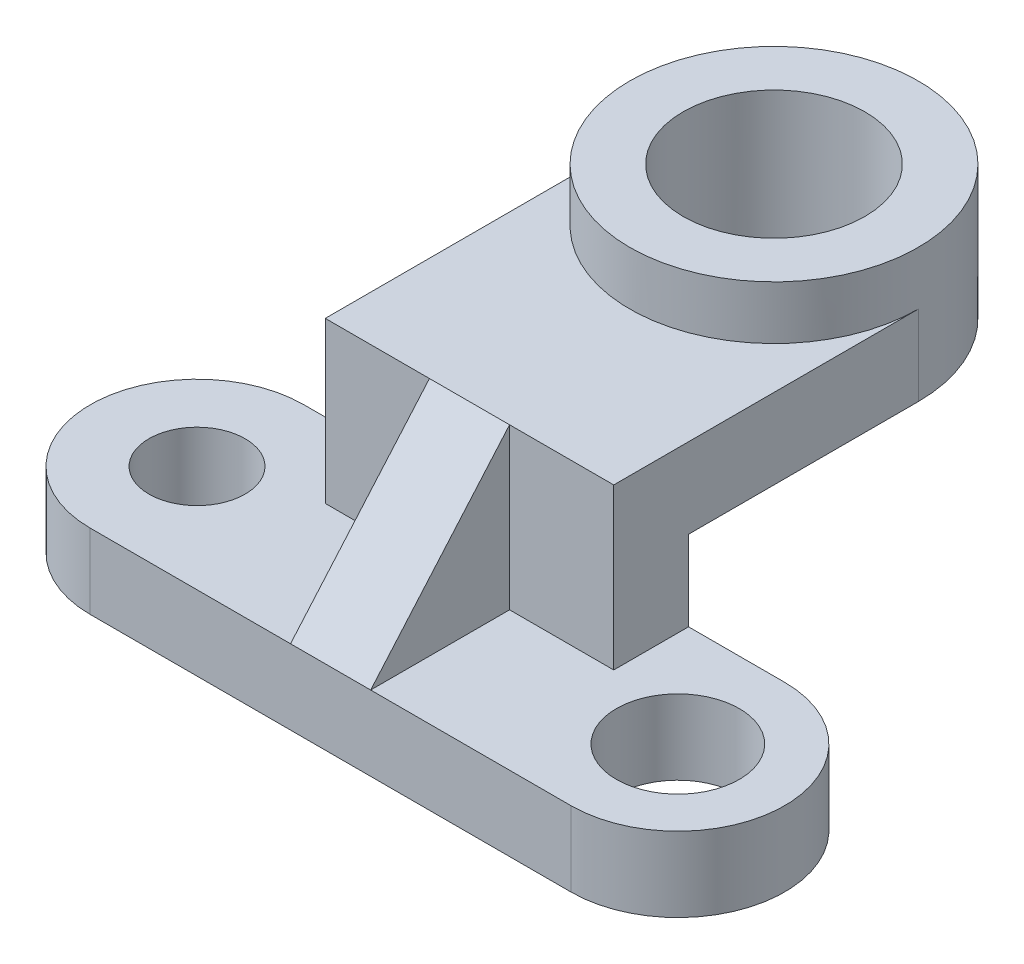
from build123d import *

# Parameters (mm, degrees)
SKETCH_1_R          = 23
SKETCH_1_R_2        = 18
EXTRUDE_1_DEPTH     = 28
EXTRUDE_3_DEPTH     = 60
SKETCH_2_5_R        = 54
SKETCH_2_5_R_2      = 34
EXTRUDE_4_DEPTH     = 80
CUT_EXTRUDE_1_DEPTH = 30
SKETCH_6_W          = 108
SKETCH_6_H          = 28
EXTRUDE_5_DEPTH     = 60
EXTRUDE_6_DEPTH     = 15


with BuildPart() as part:
    # 草图1 → 凸台-拉伸1 (new body)
    with BuildSketch(Plane(origin=(0, 0, 0), x_dir=(1, 0, 0), z_dir=(0, 1, 0))):
        with BuildLine():
            Line((0, 40), (180, 40))
            ThreePointArc((180, 40), (220, 0), (180, -40))
            Line((180, -40), (0, -40))
            ThreePointArc((0, -40), (-40, 0), (0, 40))
        make_face()
        with Locations(Location((180, 0, 0), (0, 0, 270))):
            Circle(SKETCH_1_R, mode=Mode.SUBTRACT)
        with Locations(Location((0, 0, 0), (0, 0, 270))):
            Circle(SKETCH_1_R_2, mode=Mode.SUBTRACT)
    extrude(amount=EXTRUDE_1_DEPTH)



with BuildPart() as body_2:
    # 草图2 → 凸台-拉伸3 (new body)
    with BuildSketch(Plane(origin=(0, 28, 0), x_dir=(1, 0, 0), z_dir=(0, 1, 0))):
        with BuildLine():
            Line((90, 40), (144, 40))
            Line((144, 40), (144, 126))
            ThreePointArc((144, 126), (90, 72), (36, 126))
            Line((36, 126), (36, 40))
            Line((36, 40), (90, 40))
        make_face()
    extrude(amount=EXTRUDE_3_DEPTH)

    # 草图2<5> → 凸台-拉伸4 (add)
    with BuildSketch(Plane(origin=(0, 28, 0), x_dir=(1, 0, 0), z_dir=(0, 1, 0))):
        with Locations(Location((90, 126, 0), (0, 0, 180))):
            Circle(SKETCH_2_5_R)
        with Locations(Location((90, 126, 0), (0, 0, 270))):
            Circle(SKETCH_2_5_R_2, mode=Mode.SUBTRACT)
    extrude(amount=EXTRUDE_4_DEPTH)

    # 草图4 → 切除-拉伸1 (cut)
    with BuildSketch(Plane.XZ.offset(-28)):
        with BuildLine():
            Line((36, -40), (36, -126))
            ThreePointArc((36, -126), (90, -180), (144, -126))
            Line((144, -126), (144, -40))
            Line((144, -40), (36, -40))
        make_face()
    extrude(amount=-CUT_EXTRUDE_1_DEPTH, mode=Mode.SUBTRACT)


with BuildPart() as part_1:
    add(part.part)

    add(body_2.part)  # 凸台-拉伸5 merges body 2
    # 草图6 → 凸台-拉伸5 (add)
    with BuildSketch(Plane(origin=(0, 28, 0), x_dir=(1, 0, 0), z_dir=(0, 1, 0))):
        with Locations((90, 26)):
            Rectangle(SKETCH_6_W, SKETCH_6_H)
    extrude(amount=EXTRUDE_5_DEPTH)

    # 草图7 → 凸台-拉伸6 (add, symmetric)
    with BuildSketch(Plane.ZY.offset(-90)):
        Polygon((40, 28), (-12, 28), (-12, 88), align=None)
    extrude(amount=EXTRUDE_6_DEPTH, both=True)


solid = part_1.part
